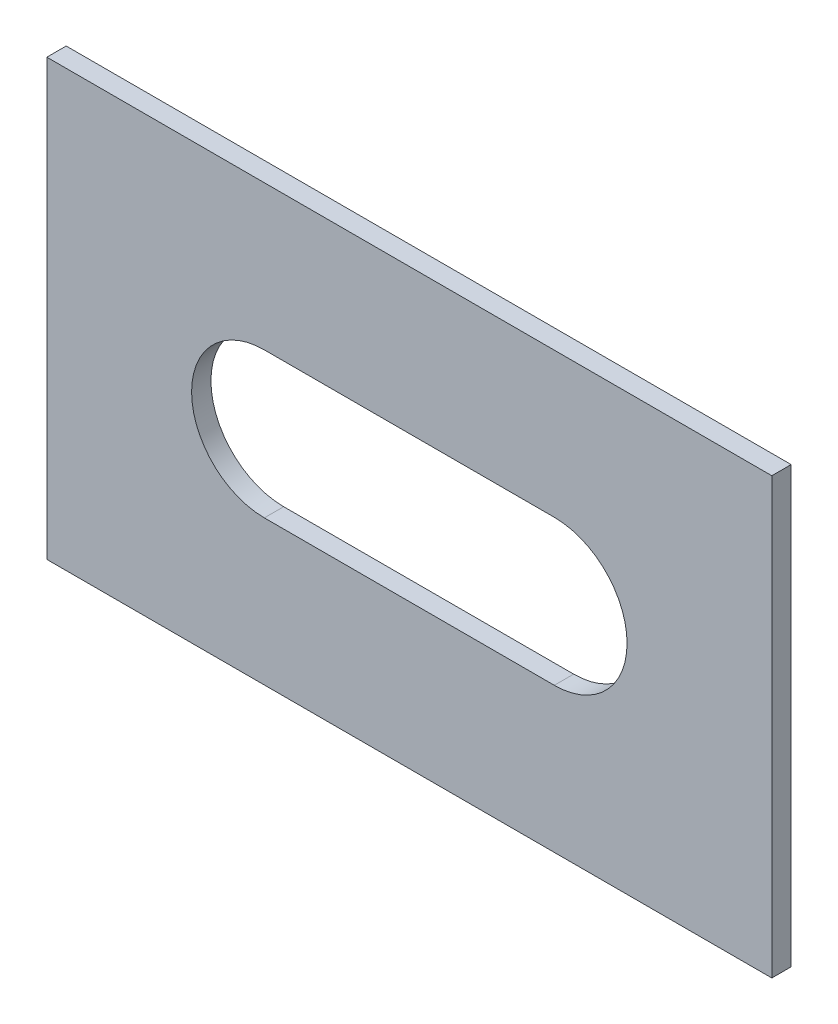
from build123d import *

# Parameters (mm, degrees)
SKETCH1_W           = 150
SKETCH1_H           = 90
BOSS_EXTRUDE1_DEPTH = 4


with BuildPart() as part:
    # Sketch1 → Boss-Extrude1 (new body)
    with BuildSketch(Plane.XY):
        with Locations((75, 45)):
            Rectangle(SKETCH1_W, SKETCH1_H)
        with BuildLine():
            Line((45, 29.95), (105, 29.95))
            ThreePointArc((105, 29.95), (120.05, 45), (105, 60.05))
            Line((105, 60.05), (45, 60.05))
            ThreePointArc((45, 60.05), (29.95, 45), (45, 29.95))
        make_face(mode=Mode.SUBTRACT)
    extrude(amount=BOSS_EXTRUDE1_DEPTH)


solid = part.part
